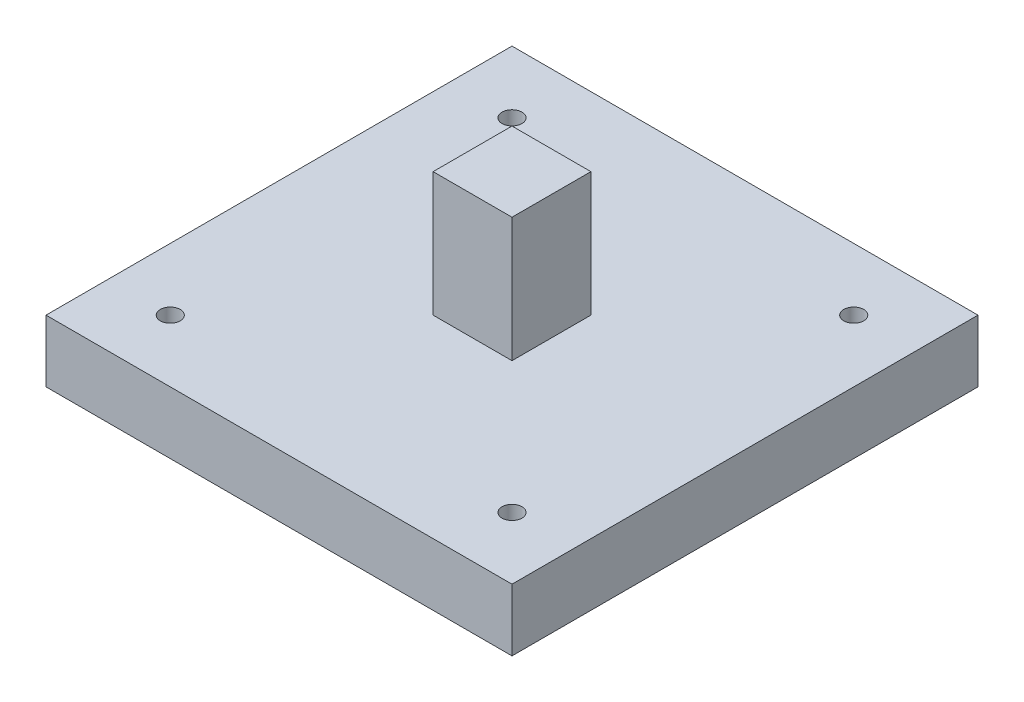
from build123d import *

# Parameters (mm, degrees)
SKETCH_1_W          = 75
SKETCH_1_H          = 75
EXTRUDE_1_DEPTH     = 10
SKETCH_2_R          = 1.6
CUT_EXTRUDE_1_DEPTH = 10
SKETCH_3_W          = 12.7
SKETCH_3_H          = 12.7
EXTRUDE_2_DEPTH     = 20


with BuildPart() as part:
    # Эскиз1 → Бобышка-Вытянуть1 (new body)
    with BuildSketch(Plane(origin=(0, 0, 0), x_dir=(1, 0, 0), z_dir=(0, 1, 0))):
        with Locations((2.261306533, -8.291457286)):
            Rectangle(SKETCH_1_W, SKETCH_1_H)
    extrude(amount=EXTRUDE_1_DEPTH)

    # Эскиз2 → Вырез-Вытянуть1 (cut)
    with BuildSketch(Plane(origin=(0, 10, 0), x_dir=(1, 0, 0), z_dir=(0, 1, 0))):
        with Locations(Location((-25.238693467, 19.208542714, 0), (0, 0, 270))):
            Circle(SKETCH_2_R)
        with Locations(Location((29.761306533, 19.208542714, 0), (0, 0, 270))):
            Circle(SKETCH_2_R)
        with Locations(Location((-25.238693467, -35.791457286, 0), (0, 0, 270))):
            Circle(SKETCH_2_R)
        with Locations(Location((29.761306533, -35.791457286, 0), (0, 0, 270))):
            Circle(SKETCH_2_R)
    extrude(amount=-CUT_EXTRUDE_1_DEPTH, mode=Mode.SUBTRACT)

    # Эскиз3 → Бобышка-Вытянуть2 (add)
    with BuildSketch(Plane(origin=(0, 10, 0), x_dir=(1, 0, 0), z_dir=(0, 1, 0))):
        with Locations((2.261306533, -8.291457286)):
            Rectangle(SKETCH_3_W, SKETCH_3_H)
    extrude(amount=EXTRUDE_2_DEPTH)


solid = part.part
